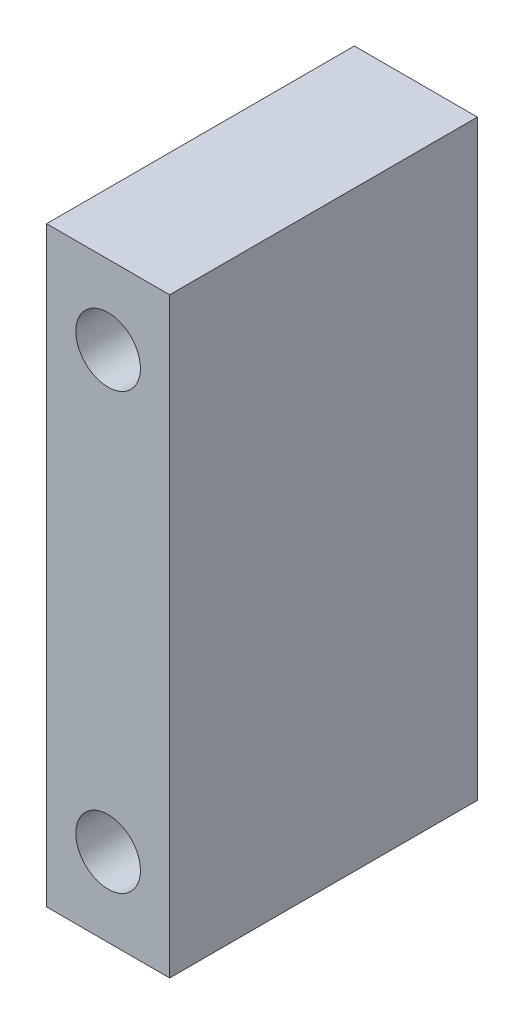
from build123d import *

# Parameters (mm, degrees)
ESQUISSE1_W        = 8
ESQUISSE1_H        = 38.45
ESQUISSE1_R        = 2.1
BOSS_EXTRU_1_DEPTH = 20


with BuildPart() as part:
    # Esquisse1 → Boss.-Extru.1 (new body)
    with BuildSketch(Plane.XY):
        with Locations((-4, 19.225)):
            Rectangle(ESQUISSE1_W, ESQUISSE1_H)
        with Locations((-4, 33.35)):
            Circle(ESQUISSE1_R, mode=Mode.SUBTRACT)
        with Locations((-4, 5.1)):
            Circle(ESQUISSE1_R, mode=Mode.SUBTRACT)
    extrude(amount=BOSS_EXTRU_1_DEPTH)


solid = part.part
